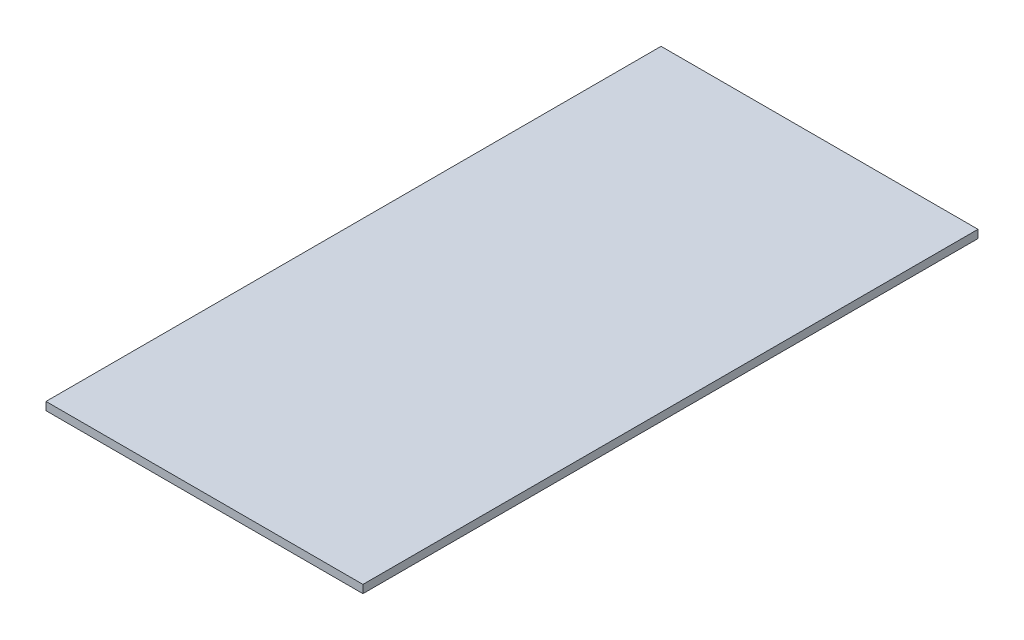
from build123d import *

# Parameters (mm, degrees)
SKETCH1_W           = 118
SKETCH1_H           = 229
BOSS_EXTRUDE1_DEPTH = 3


with BuildPart() as part:
    # Sketch1 → Boss-Extrude1 (new body)
    with BuildSketch(Plane(origin=(0, 0, 0), x_dir=(1, 0, 0), z_dir=(0, 1, 0))):
        Rectangle(SKETCH1_W, SKETCH1_H)
    extrude(amount=BOSS_EXTRUDE1_DEPTH)


solid = part.part
